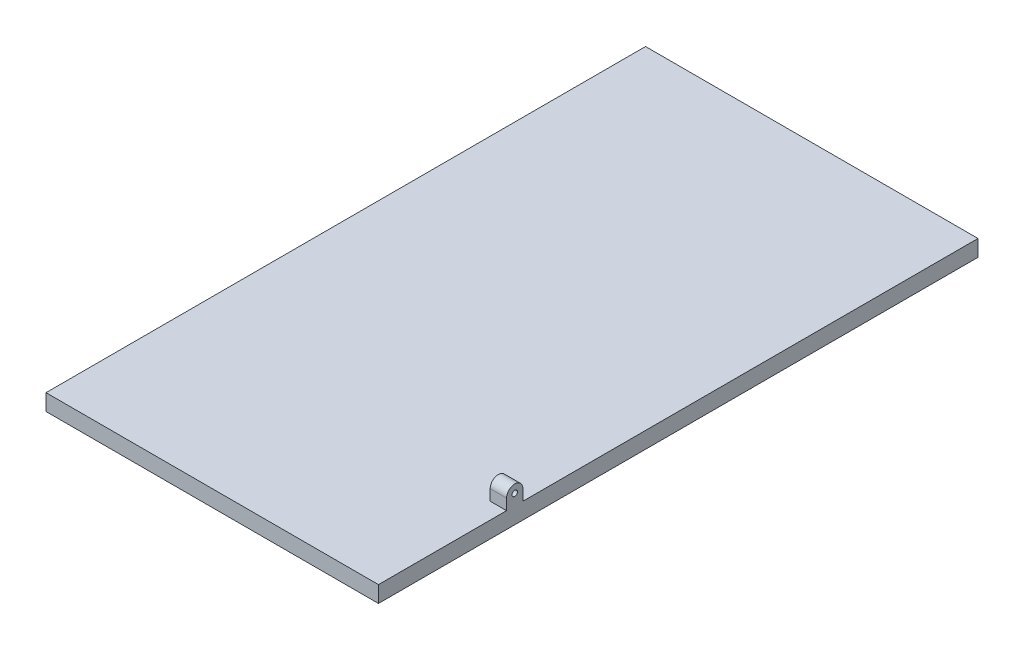
from build123d import *

# Parameters (mm, degrees)
SKETCH1_W           = 61
SKETCH1_H           = 100
BOSS_EXTRUDE1_DEPTH = 3
SKETCH4_W           = 61
SKETCH4_H           = 3
BOSS_EXTRUDE3_DEPTH = 10
SKETCH8_R           = 0.5
BOSS_EXTRUDE6_DEPTH = 3


with BuildPart() as part:
    # Sketch1 → Boss-Extrude1 (new body)
    with BuildSketch(Plane(origin=(0, 0, 0), x_dir=(1, 0, 0), z_dir=(0, 1, 0))):
        with Locations((30.5, 50)):
            Rectangle(SKETCH1_W, SKETCH1_H)
    extrude(amount=BOSS_EXTRUDE1_DEPTH)

    # Sketch4 → Boss-Extrude3 (add)
    with BuildSketch(Plane.XY):
        with Locations((30.5, 1.5)):
            Rectangle(SKETCH4_W, SKETCH4_H)
    extrude(amount=BOSS_EXTRUDE3_DEPTH)

    # Sketch8 → Boss-Extrude6 (add)
    with BuildSketch(Plane(origin=(61, 0, 0), x_dir=(0, 0, -1), z_dir=(1, 0, 0))):
        with BuildLine():
            Line((13.5, 3), (16.5, 3))
            Line((16.5, 3), (16.5, 5))
            ThreePointArc((16.5, 5), (15, 6.5), (13.5, 5))
            Line((13.5, 5), (13.5, 3))
        make_face()
        with Locations(Location((15, 5, 0), (0, 0, 180))):
            Circle(SKETCH8_R, mode=Mode.SUBTRACT)
    extrude(amount=-BOSS_EXTRUDE6_DEPTH)


solid = part.part
